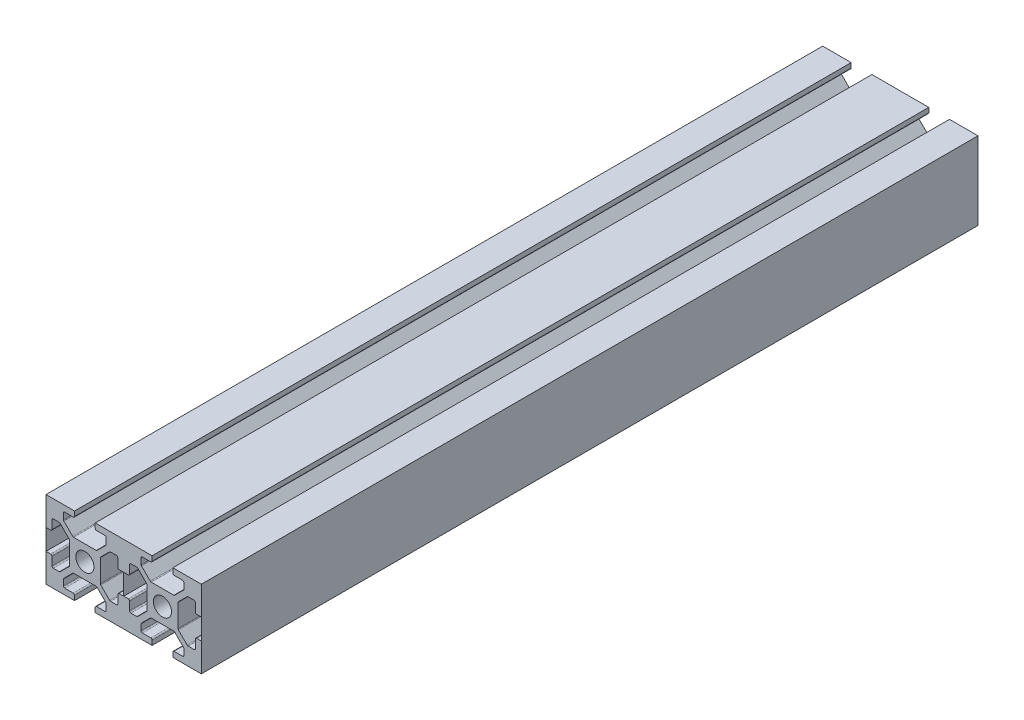
from build123d import *

# Parameters (mm, degrees)
CROQUIS1_W              = 40
CROQUIS1_H              = 20
SALIENTE_EXTRUIR1_DEPTH = 200
CROQUIS2_R              = 2.3345
CORTAR_EXTRUIR1_DEPTH   = 200


with BuildPart() as part:
    # Croquis1 → Saliente-Extruir1 (new body)
    with BuildSketch(Plane.XY):
        Rectangle(CROQUIS1_W, CROQUIS1_H)
    extrude(amount=SALIENTE_EXTRUIR1_DEPTH)

    # Croquis2 → Cortar-Extruir1 (cut)
    with BuildSketch(Plane.XY.offset(200)):
        with BuildLine():
            ThreePointArc((-15.49275, 6.608040223), (-15.467363824, 6.480415298), (-15.395070112, 6.372220112))
            Line((-15.395070112, 6.372220112), (-13.122529888, 4.099679888))
            ThreePointArc((-13.122529888, 4.099679888), (-13.014334702, 4.027386176), (-12.886709777, 4.002))
            Line((-12.886709777, 4.002), (-7.093290223, 4.002))
            ThreePointArc((-7.093290223, 4.002), (-6.965665298, 4.027386176), (-6.857470112, 4.099679888))
            Line((-6.857470112, 4.099679888), (-4.584929888, 6.372220112))
            ThreePointArc((-4.584929888, 6.372220112), (-4.512636176, 6.480415298), (-4.48725, 6.608040223))
            Line((-4.48725, 6.608040223), (-4.48725, 8.1374))
            ThreePointArc((-4.48725, 8.1374), (-4.584929888, 8.373220112), (-4.82075, 8.4709))
            Line((-4.82075, 8.4709), (-6.9885, 8.4709))
            ThreePointArc((-6.9885, 8.4709), (-7.224320112, 8.568579888), (-7.322, 8.8044))
            Line((-7.322, 8.8044), (-7.322, 10))
            Line((-7.322, 10), (-12.658, 10))
            Line((-12.658, 10), (-12.658, 8.8044))
            ThreePointArc((-12.658, 8.8044), (-12.755679888, 8.568579888), (-12.9915, 8.4709))
            Line((-12.9915, 8.4709), (-15.15925, 8.4709))
            ThreePointArc((-15.15925, 8.4709), (-15.395070112, 8.373220112), (-15.49275, 8.1374))
            Line((-15.49275, 8.1374), (-15.49275, 6.608040223))
        make_face()
        with BuildLine():
            Line((-18.1274, -5.50275), (-16.598040223, -5.50275))
            ThreePointArc((-16.598040223, -5.50275), (-16.470415298, -5.477363824), (-16.362220112, -5.405070112))
            Line((-16.362220112, -5.405070112), (-14.089679888, -3.132529888))
            ThreePointArc((-14.089679888, -3.132529888), (-14.017386176, -3.024334702), (-13.992, -2.896709777))
            Line((-13.992, -2.896709777), (-13.992, 2.896709777))
            ThreePointArc((-13.992, 2.896709777), (-14.017386176, 3.024334702), (-14.089679888, 3.132529888))
            Line((-14.089679888, 3.132529888), (-16.362220112, 5.405070112))
            ThreePointArc((-16.362220112, 5.405070112), (-16.470415298, 5.477363824), (-16.598040223, 5.50275))
            Line((-16.598040223, 5.50275), (-18.1274, 5.50275))
            ThreePointArc((-18.1274, 5.50275), (-18.363220112, 5.405070112), (-18.4609, 5.16925))
            Line((-18.4609, 5.16925), (-18.4609, 3.0015))
            ThreePointArc((-18.4609, 3.0015), (-18.558579888, 2.765679888), (-18.7944, 2.668))
            Line((-18.7944, 2.668), (-19.995, 2.668))
            Line((-19.995, 2.668), (-19.995, -2.668))
            Line((-19.995, -2.668), (-18.7944, -2.668))
            ThreePointArc((-18.7944, -2.668), (-18.558579888, -2.765679888), (-18.4609, -3.0015))
            Line((-18.4609, -3.0015), (-18.4609, -5.16925))
            ThreePointArc((-18.4609, -5.16925), (-18.363220112, -5.405070112), (-18.1274, -5.50275))
        make_face()
        with BuildLine():
            ThreePointArc((-4.48725, -6.608040223), (-4.512636176, -6.480415298), (-4.584929888, -6.372220112))
            Line((-4.584929888, -6.372220112), (-6.857470112, -4.099679888))
            ThreePointArc((-6.857470112, -4.099679888), (-6.965665298, -4.027386176), (-7.093290223, -4.002))
            Line((-7.093290223, -4.002), (-12.886709777, -4.002))
            ThreePointArc((-12.886709777, -4.002), (-13.014334702, -4.027386176), (-13.122529888, -4.099679888))
            Line((-13.122529888, -4.099679888), (-15.395070112, -6.372220112))
            ThreePointArc((-15.395070112, -6.372220112), (-15.467363824, -6.480415298), (-15.49275, -6.608040223))
            Line((-15.49275, -6.608040223), (-15.49275, -8.1374))
            ThreePointArc((-15.49275, -8.1374), (-15.395070112, -8.373220112), (-15.15925, -8.4709))
            Line((-15.15925, -8.4709), (-12.9915, -8.4709))
            ThreePointArc((-12.9915, -8.4709), (-12.755679888, -8.568579888), (-12.658, -8.8044))
            Line((-12.658, -8.8044), (-12.658, -10))
            Line((-12.658, -10), (-7.322, -10))
            Line((-7.322, -10), (-7.322, -8.8044))
            ThreePointArc((-7.322, -8.8044), (-7.224320112, -8.568579888), (-6.9885, -8.4709))
            Line((-6.9885, -8.4709), (-4.82075, -8.4709))
            ThreePointArc((-4.82075, -8.4709), (-4.584929888, -8.373220112), (-4.48725, -8.1374))
            Line((-4.48725, -8.1374), (-4.48725, -6.608040223))
        make_face()
        with Locations((-9.99, 0)):
            Circle(CROQUIS2_R)
        with BuildLine():
            ThreePointArc((-3.381959777, 5.50275), (-3.509584702, 5.477363824), (-3.617779888, 5.405070112))
            Line((-3.617779888, 5.405070112), (-5.890320112, 3.132529888))
            ThreePointArc((-5.890320112, 3.132529888), (-5.962613824, 3.024334702), (-5.988, 2.896709777))
            Line((-5.988, 2.896709777), (-5.988, -2.896709777))
            ThreePointArc((-5.988, -2.896709777), (-5.962613824, -3.024334702), (-5.890320112, -3.132529888))
            Line((-5.890320112, -3.132529888), (-3.617779888, -5.405070112))
            ThreePointArc((-3.617779888, -5.405070112), (-3.509584702, -5.477363824), (-3.381959777, -5.50275))
            Line((-3.381959777, -5.50275), (-1.8526, -5.50275))
            ThreePointArc((-1.8526, -5.50275), (-1.616779888, -5.405070112), (-1.5191, -5.16925))
            Line((-1.5191, -5.16925), (-1.5191, -3.0015))
            ThreePointArc((-1.5191, -3.0015), (-1.421420112, -2.765679888), (-1.1856, -2.668))
            Line((-1.1856, -2.668), (-0.015, -2.668))
            Line((-0.015, -2.668), (-0.015, 2.668))
            Line((-0.015, 2.668), (-1.1856, 2.668))
            ThreePointArc((-1.1856, 2.668), (-1.421420112, 2.765679888), (-1.5191, 3.0015))
            Line((-1.5191, 3.0015), (-1.5191, 5.16925))
            ThreePointArc((-1.5191, 5.16925), (-1.616779888, 5.405070112), (-1.8526, 5.50275))
            Line((-1.8526, 5.50275), (-3.381959777, 5.50275))
        make_face()
        with BuildLine():
            Line((1.1856, 2.668), (0.015, 2.668))
            Line((0.015, 2.668), (0.015, -2.668))
            Line((0.015, -2.668), (1.1856, -2.668))
            ThreePointArc((1.1856, -2.668), (1.421420112, -2.765679888), (1.5191, -3.0015))
            Line((1.5191, -3.0015), (1.5191, -5.16925))
            ThreePointArc((1.5191, -5.16925), (1.616779888, -5.405070112), (1.8526, -5.50275))
            Line((1.8526, -5.50275), (3.381959777, -5.50275))
            ThreePointArc((3.381959777, -5.50275), (3.509584702, -5.477363824), (3.617779888, -5.405070112))
            Line((3.617779888, -5.405070112), (5.890320112, -3.132529888))
            ThreePointArc((5.890320112, -3.132529888), (5.962613824, -3.024334702), (5.988, -2.896709777))
            Line((5.988, -2.896709777), (5.988, 2.896709777))
            ThreePointArc((5.988, 2.896709777), (5.962613824, 3.024334702), (5.890320112, 3.132529888))
            Line((5.890320112, 3.132529888), (3.617779888, 5.405070112))
            ThreePointArc((3.617779888, 5.405070112), (3.509584702, 5.477363824), (3.381959777, 5.50275))
            Line((3.381959777, 5.50275), (1.8526, 5.50275))
            ThreePointArc((1.8526, 5.50275), (1.616779888, 5.405070112), (1.5191, 5.16925))
            Line((1.5191, 5.16925), (1.5191, 3.0015))
            ThreePointArc((1.5191, 3.0015), (1.421420112, 2.765679888), (1.1856, 2.668))
        make_face()
        with BuildLine():
            Line((12.658, 10), (7.322, 10))
            Line((7.322, 10), (7.322, 8.8044))
            ThreePointArc((7.322, 8.8044), (7.224320112, 8.568579888), (6.9885, 8.4709))
            Line((6.9885, 8.4709), (4.82075, 8.4709))
            ThreePointArc((4.82075, 8.4709), (4.584929888, 8.373220112), (4.48725, 8.1374))
            Line((4.48725, 8.1374), (4.48725, 6.608040223))
            ThreePointArc((4.48725, 6.608040223), (4.512636176, 6.480415298), (4.584929888, 6.372220112))
            Line((4.584929888, 6.372220112), (6.857470112, 4.099679888))
            ThreePointArc((6.857470112, 4.099679888), (6.965665298, 4.027386176), (7.093290223, 4.002))
            Line((7.093290223, 4.002), (12.886709777, 4.002))
            ThreePointArc((12.886709777, 4.002), (13.014334702, 4.027386176), (13.122529888, 4.099679888))
            Line((13.122529888, 4.099679888), (15.395070112, 6.372220112))
            ThreePointArc((15.395070112, 6.372220112), (15.467363824, 6.480415298), (15.49275, 6.608040223))
            Line((15.49275, 6.608040223), (15.49275, 8.1374))
            ThreePointArc((15.49275, 8.1374), (15.395070112, 8.373220112), (15.15925, 8.4709))
            Line((15.15925, 8.4709), (12.9915, 8.4709))
            ThreePointArc((12.9915, 8.4709), (12.755679888, 8.568579888), (12.658, 8.8044))
            Line((12.658, 8.8044), (12.658, 10))
        make_face()
        with Locations((9.99, 0)):
            Circle(CROQUIS2_R)
        with BuildLine():
            ThreePointArc((14.089679888, -3.132529888), (14.017386176, -3.024334702), (13.992, -2.896709777))
            Line((13.992, -2.896709777), (13.992, 2.896709777))
            ThreePointArc((13.992, 2.896709777), (14.017386176, 3.024334702), (14.089679888, 3.132529888))
            Line((14.089679888, 3.132529888), (16.362220112, 5.405070112))
            ThreePointArc((16.362220112, 5.405070112), (16.470415298, 5.477363824), (16.598040223, 5.50275))
            Line((16.598040223, 5.50275), (18.1274, 5.50275))
            ThreePointArc((18.1274, 5.50275), (18.363220112, 5.405070112), (18.4609, 5.16925))
            Line((18.4609, 5.16925), (18.4609, 3.0015))
            ThreePointArc((18.4609, 3.0015), (18.558579888, 2.765679888), (18.7944, 2.668))
            Line((18.7944, 2.668), (19.995, 2.668))
            Line((19.995, 2.668), (19.995, -2.668))
            Line((19.995, -2.668), (18.7944, -2.668))
            ThreePointArc((18.7944, -2.668), (18.558579888, -2.765679888), (18.4609, -3.0015))
            Line((18.4609, -3.0015), (18.4609, -5.16925))
            ThreePointArc((18.4609, -5.16925), (18.363220112, -5.405070112), (18.1274, -5.50275))
            Line((18.1274, -5.50275), (16.598040223, -5.50275))
            ThreePointArc((16.598040223, -5.50275), (16.470415298, -5.477363824), (16.362220112, -5.405070112))
            Line((16.362220112, -5.405070112), (14.089679888, -3.132529888))
        make_face()
        with BuildLine():
            Line((7.322, -8.8044), (7.322, -10))
            Line((7.322, -10), (12.658, -10))
            Line((12.658, -10), (12.658, -8.8044))
            ThreePointArc((12.658, -8.8044), (12.755679888, -8.568579888), (12.9915, -8.4709))
            Line((12.9915, -8.4709), (15.15925, -8.4709))
            ThreePointArc((15.15925, -8.4709), (15.395070112, -8.373220112), (15.49275, -8.1374))
            Line((15.49275, -8.1374), (15.49275, -6.608040223))
            ThreePointArc((15.49275, -6.608040223), (15.467363824, -6.480415298), (15.395070112, -6.372220112))
            Line((15.395070112, -6.372220112), (13.122529888, -4.099679888))
            ThreePointArc((13.122529888, -4.099679888), (13.014334702, -4.027386176), (12.886709777, -4.002))
            Line((12.886709777, -4.002), (7.093290223, -4.002))
            ThreePointArc((7.093290223, -4.002), (6.965665298, -4.027386176), (6.857470112, -4.099679888))
            Line((6.857470112, -4.099679888), (4.584929888, -6.372220112))
            ThreePointArc((4.584929888, -6.372220112), (4.512636176, -6.480415298), (4.48725, -6.608040223))
            Line((4.48725, -6.608040223), (4.48725, -8.1374))
            ThreePointArc((4.48725, -8.1374), (4.584929888, -8.373220112), (4.82075, -8.4709))
            Line((4.82075, -8.4709), (6.9885, -8.4709))
            ThreePointArc((6.9885, -8.4709), (7.224320112, -8.568579888), (7.322, -8.8044))
        make_face()
    extrude(amount=-CORTAR_EXTRUIR1_DEPTH, mode=Mode.SUBTRACT)


solid = part.part
